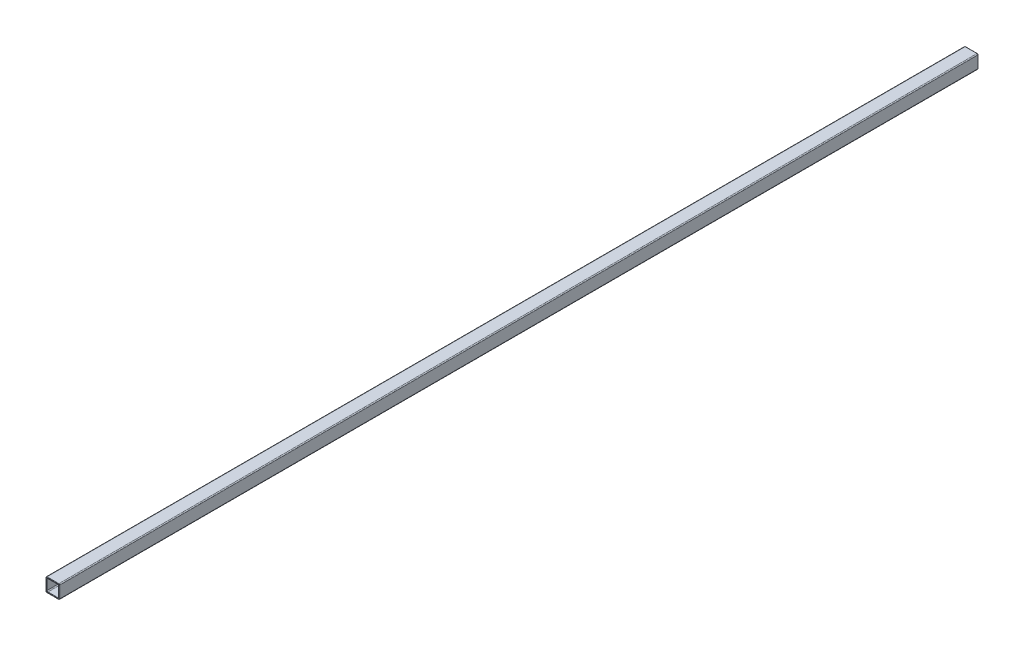
from build123d import *

# Parameters (mm, degrees)
BOSS_EXTRUDE1_DEPTH = 2570
FILLET1_R           = 1


with BuildPart() as part:
    # Sketch1 → Boss-Extrude1 (new body)
    with BuildSketch(Plane.XY):
        with BuildLine():
            Line((2.54, 0), (35.56, 0))
            ThreePointArc((35.56, 0), (37.356051224, -0.743948776), (38.1, -2.54))
            Line((38.1, -2.54), (38.1, -35.56))
            ThreePointArc((38.1, -35.56), (37.356051224, -37.356051224), (35.56, -38.1))
            Line((35.56, -38.1), (2.54, -38.1))
            ThreePointArc((2.54, -38.1), (0.743948776, -37.356051224), (0, -35.56))
            Line((0, -35.56), (0, -2.54))
            ThreePointArc((0, -2.54), (0.743948776, -0.743948776), (2.54, 0))
        make_face()
        with BuildLine():
            Line((5.3086, -2.7686), (32.7914, -2.7686))
            ThreePointArc((32.7914, -2.7686), (34.587451224, -3.512548776), (35.3314, -5.3086))
            Line((35.3314, -5.3086), (35.3314, -32.7914))
            ThreePointArc((35.3314, -32.7914), (34.587451224, -34.587451224), (32.7914, -35.3314))
            Line((32.7914, -35.3314), (5.3086, -35.3314))
            ThreePointArc((5.3086, -35.3314), (3.512548776, -34.587451224), (2.7686, -32.7914))
            Line((2.7686, -32.7914), (2.7686, -5.3086))
            ThreePointArc((2.7686, -5.3086), (3.512548776, -3.512548776), (5.3086, -2.7686))
        make_face(mode=Mode.SUBTRACT)
    extrude(amount=BOSS_EXTRUDE1_DEPTH)

    # Fillet1
    fillet1_edges = [part.edges().sort_by_distance(p)[0] for p in [
        (37.356051224, -37.356051224, 2570),
        (19.05, -38.1, 0),
        (0.743948776, -37.356051224, 0),
        (38.1, -19.05, 2570),
        (37.356051224, -0.743948776, 2570),
        (19.05, 0, 2570),
        (0.743948776, -0.743948776, 2570),
        (0, -19.05, 2570),
        (3.512548776, -34.587451224, 0),
        (19.05, -35.3314, 0),
        (34.587451224, -34.587451224, 0),
        (35.3314, -19.05, 0),
        (34.587451224, -3.512548776, 0),
        (19.05, -2.7686, 0),
        (3.512548776, -3.512548776, 0),
        (2.7686, -19.05, 0),
        (3.512548776, -34.587451224, 2570),
        (19.05, -35.3314, 2570),
        (34.587451224, -34.587451224, 2570),
        (35.3314, -19.05, 2570),
        (34.587451224, -3.512548776, 2570),
        (19.05, -2.7686, 2570),
        (3.512548776, -3.512548776, 2570),
        (2.7686, -19.05, 2570),
        (0.743948776, -37.356051224, 2570),
        (19.05, -38.1, 2570),
        (0, -19.05, 0),
        (0.743948776, -0.743948776, 0),
        (19.05, 0, 0),
        (37.356051224, -0.743948776, 0),
        (38.1, -19.05, 0),
        (37.356051224, -37.356051224, 0),
    ]]
    fillet(fillet1_edges, radius=FILLET1_R)


solid = part.part
